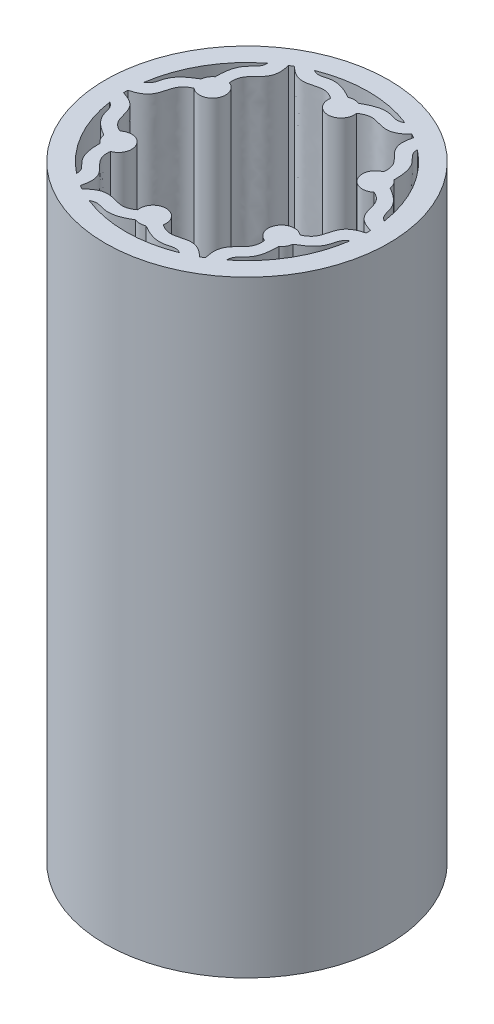
from build123d import *

# Parameters (mm, degrees)
OUTERSHELL_R        = 7
OUTERSHELL_R_2      = 6
BOSS_EXTRUDE2_DEPTH = 30
BOSS_EXTRUDE3_DEPTH = 30


with BuildPart() as part:
    # OuterShell → Boss-Extrude2 (new body)
    with BuildSketch(Plane(origin=(0, 0, 0), x_dir=(1, 0, 0), z_dir=(0, 1, 0))):
        with Locations(Location((0, 0, 0), (0, 0, 270))):
            Circle(OUTERSHELL_R)
        with Locations(Location((0, 0, 0), (0, 0, 270))):
            Circle(OUTERSHELL_R_2, mode=Mode.SUBTRACT)
    extrude(amount=BOSS_EXTRUDE2_DEPTH)

    # InnerGliders → Boss-Extrude3 (add)
    with BuildSketch(Plane(origin=(0, 0, 0), x_dir=(1, 0, 0), z_dir=(0, 1, 0))):
        with BuildLine():
            ThreePointArc((-0.639045064, 4.768833521), (0, 4), (0.639045064, 4.768833521))
            add(Edge.make_bspline(
                [(2.903513824, 5.250676858), (1.906526941, 4.241185568), (1.497667475, 5.412889387), (0.639045064, 4.768833521)],
                knots=[0, 0, 0, 0, 1, 1, 1, 1], degree=3))
            ThreePointArc((2.903513824, 5.250676858), (2.752177228, 5.79179086), (2.237066135, 5.567363389))
            add(Edge.make_bspline(
                [(0.255984355, 5.247471346), (1.537126351, 6.005779726), (1.673916409, 5.242545099), (2.237066135, 5.567363389)],
                knots=[0, 0, 0, 0, 1, 1, 1, 1], degree=3))
            ThreePointArc((0.255984355, 5.247471346), (0, 5.3), (-0.255984355, 5.247471346))
            add(Edge.make_bspline(
                [(-0.255984355, 5.247471346), (-1.537126351, 6.005779726), (-1.673916409, 5.242545099), (-2.237066135, 5.567363389)],
                knots=[0, 0, 0, 0, 1, 1, 1, 1], degree=3))
            ThreePointArc((-2.237066135, 5.567363389), (-2.752177228, 5.79179086), (-2.903513824, 5.250676858))
            add(Edge.make_bspline(
                [(-2.903513824, 5.250676858), (-1.906526941, 4.241185568), (-1.497667475, 5.412889387), (-0.639045064, 4.768833521)],
                knots=[0, 0, 0, 0, 1, 1, 1, 1], degree=3))
        make_face()
        with BuildLine():
            ThreePointArc((3.810408444, 2.93784602), (3.464101615, 2), (4.449453508, 1.830987501))
            add(Edge.make_bspline(
                [(5.998976459, 0.110821697), (4.626237915, 0.46949202), (5.436533454, 1.409426614), (4.449453508, 1.830987501)],
                knots=[0, 0, 0, 0, 1, 1, 1, 1], degree=3))
            ThreePointArc((5.998976459, 0.110821697), (6.391926632, 0.512440035), (5.940011195, 0.846325592))
            add(Edge.make_bspline(
                [(4.672435669, 2.402046718), (5.969720988, 1.671699395), (5.377135441, 1.171618415), (5.940011195, 0.846325592)],
                knots=[0, 0, 0, 0, 1, 1, 1, 1], degree=3))
            ThreePointArc((4.672435669, 2.402046718), (4.58993464, 2.65), (4.416451314, 2.845424628))
            add(Edge.make_bspline(
                [(4.416451314, 2.845424628), (4.432594637, 4.334080332), (3.703219031, 4.070926684), (3.70294506, 4.721037798)],
                knots=[0, 0, 0, 0, 1, 1, 1, 1], degree=3))
            ThreePointArc((3.70294506, 4.721037798), (3.639749404, 5.279350825), (3.095462634, 5.139855161))
            add(Edge.make_bspline(
                [(3.095462634, 5.139855161), (2.719710974, 3.771693548), (3.938865979, 4.003462773), (3.810408444, 2.93784602)],
                knots=[0, 0, 0, 0, 1, 1, 1, 1], degree=3))
        make_face()
        with BuildLine():
            ThreePointArc((4.449453508, -1.830987501), (3.464101615, -2), (3.810408444, -2.93784602))
            add(Edge.make_bspline(
                [(3.095462634, -5.139855161), (2.719710974, -3.771693548), (3.938865979, -4.003462773), (3.810408444, -2.93784602)],
                knots=[0, 0, 0, 0, 1, 1, 1, 1], degree=3))
            ThreePointArc((3.095462634, -5.139855161), (3.639749404, -5.279350825), (3.70294506, -4.721037798))
            add(Edge.make_bspline(
                [(4.416451314, -2.845424628), (4.432594637, -4.334080332), (3.703219031, -4.070926684), (3.70294506, -4.721037798)],
                knots=[0, 0, 0, 0, 1, 1, 1, 1], degree=3))
            ThreePointArc((4.416451314, -2.845424628), (4.58993464, -2.65), (4.672435669, -2.402046718))
            add(Edge.make_bspline(
                [(4.672435669, -2.402046718), (5.969720988, -1.671699395), (5.377135441, -1.171618415), (5.940011195, -0.846325592)],
                knots=[0, 0, 0, 0, 1, 1, 1, 1], degree=3))
            ThreePointArc((5.940011195, -0.846325592), (6.391926632, -0.512440035), (5.998976459, -0.110821697))
            add(Edge.make_bspline(
                [(5.998976459, -0.110821697), (4.626237915, -0.46949202), (5.436533454, -1.409426614), (4.449453508, -1.830987501)],
                knots=[0, 0, 0, 0, 1, 1, 1, 1], degree=3))
        make_face()
        with BuildLine():
            ThreePointArc((0.639045064, -4.768833521), (0, -4), (-0.639045064, -4.768833521))
            add(Edge.make_bspline(
                [(-2.903513824, -5.250676858), (-1.906526941, -4.241185568), (-1.497667475, -5.412889387), (-0.639045064, -4.768833521)],
                knots=[0, 0, 0, 0, 1, 1, 1, 1], degree=3))
            ThreePointArc((-2.903513824, -5.250676858), (-2.752177228, -5.79179086), (-2.237066135, -5.567363389))
            add(Edge.make_bspline(
                [(-0.255984355, -5.247471346), (-1.537126351, -6.005779726), (-1.673916409, -5.242545099), (-2.237066135, -5.567363389)],
                knots=[0, 0, 0, 0, 1, 1, 1, 1], degree=3))
            ThreePointArc((-0.255984355, -5.247471346), (0, -5.3), (0.255984355, -5.247471346))
            add(Edge.make_bspline(
                [(0.255984355, -5.247471346), (1.537126351, -6.005779726), (1.673916409, -5.242545099), (2.237066135, -5.567363389)],
                knots=[0, 0, 0, 0, 1, 1, 1, 1], degree=3))
            ThreePointArc((2.237066135, -5.567363389), (2.752177228, -5.79179086), (2.903513824, -5.250676858))
            add(Edge.make_bspline(
                [(2.903513824, -5.250676858), (1.906526941, -4.241185568), (1.497667475, -5.412889387), (0.639045064, -4.768833521)],
                knots=[0, 0, 0, 0, 1, 1, 1, 1], degree=3))
        make_face()
        with BuildLine():
            ThreePointArc((-3.810408444, -2.93784602), (-3.464101615, -2), (-4.449453508, -1.830987501))
            add(Edge.make_bspline(
                [(-5.998976459, -0.110821697), (-4.626237915, -0.46949202), (-5.436533454, -1.409426614), (-4.449453508, -1.830987501)],
                knots=[0, 0, 0, 0, 1, 1, 1, 1], degree=3))
            ThreePointArc((-5.998976459, -0.110821697), (-6.391926632, -0.512440035), (-5.940011195, -0.846325592))
            add(Edge.make_bspline(
                [(-4.672435669, -2.402046718), (-5.969720988, -1.671699395), (-5.377135441, -1.171618415), (-5.940011195, -0.846325592)],
                knots=[0, 0, 0, 0, 1, 1, 1, 1], degree=3))
            ThreePointArc((-4.672435669, -2.402046718), (-4.58993464, -2.65), (-4.416451314, -2.845424628))
            add(Edge.make_bspline(
                [(-4.416451314, -2.845424628), (-4.432594637, -4.334080332), (-3.703219031, -4.070926684), (-3.70294506, -4.721037798)],
                knots=[0, 0, 0, 0, 1, 1, 1, 1], degree=3))
            ThreePointArc((-3.70294506, -4.721037798), (-3.639749404, -5.279350825), (-3.095462634, -5.139855161))
            add(Edge.make_bspline(
                [(-3.095462634, -5.139855161), (-2.719710974, -3.771693548), (-3.938865979, -4.003462773), (-3.810408444, -2.93784602)],
                knots=[0, 0, 0, 0, 1, 1, 1, 1], degree=3))
        make_face()
        with BuildLine():
            ThreePointArc((-4.449453508, 1.830987501), (-3.464101615, 2), (-3.810408444, 2.93784602))
            add(Edge.make_bspline(
                [(-3.095462634, 5.139855161), (-2.719710974, 3.771693548), (-3.938865979, 4.003462773), (-3.810408444, 2.93784602)],
                knots=[0, 0, 0, 0, 1, 1, 1, 1], degree=3))
            ThreePointArc((-3.095462634, 5.139855161), (-3.639749404, 5.279350825), (-3.70294506, 4.721037798))
            add(Edge.make_bspline(
                [(-4.416451314, 2.845424628), (-4.432594637, 4.334080332), (-3.703219031, 4.070926684), (-3.70294506, 4.721037798)],
                knots=[0, 0, 0, 0, 1, 1, 1, 1], degree=3))
            ThreePointArc((-4.416451314, 2.845424628), (-4.58993464, 2.65), (-4.672435669, 2.402046718))
            add(Edge.make_bspline(
                [(-4.672435669, 2.402046718), (-5.969720988, 1.671699395), (-5.377135441, 1.171618415), (-5.940011195, 0.846325592)],
                knots=[0, 0, 0, 0, 1, 1, 1, 1], degree=3))
            ThreePointArc((-5.940011195, 0.846325592), (-6.391926632, 0.512440035), (-5.998976459, 0.110821697))
            add(Edge.make_bspline(
                [(-5.998976459, 0.110821697), (-4.626237915, 0.46949202), (-5.436533454, 1.409426614), (-4.449453508, 1.830987501)],
                knots=[0, 0, 0, 0, 1, 1, 1, 1], degree=3))
        make_face()
    extrude(amount=BOSS_EXTRUDE3_DEPTH)


solid = part.part
